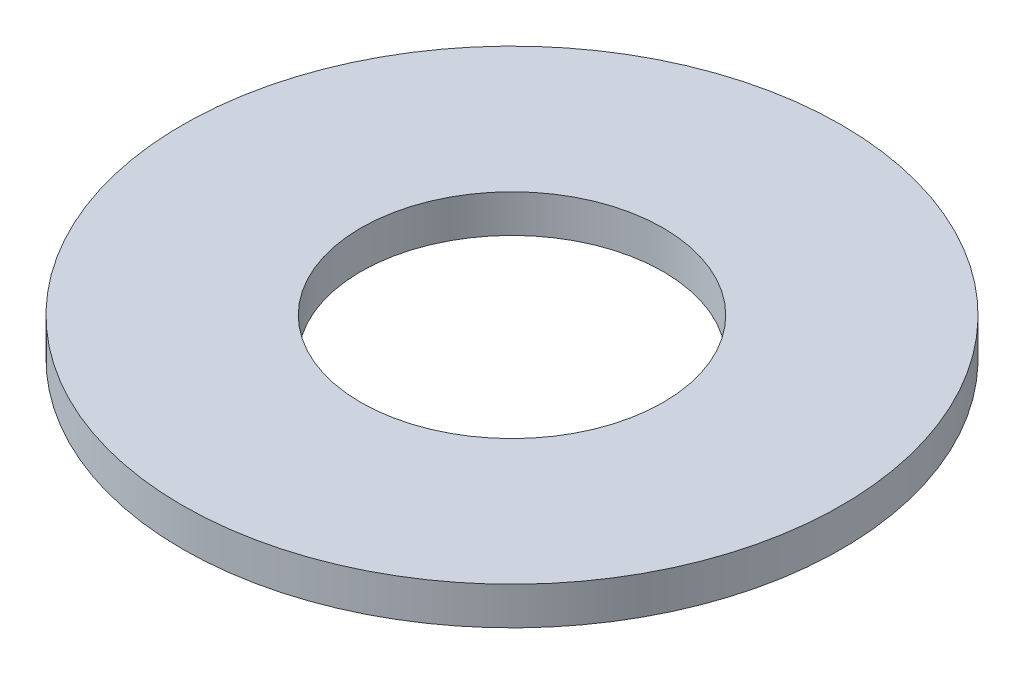
from build123d import *

# Parameters (mm, degrees)
SKETCH1_R           = 9.525
BOSS_EXTRUDE1_DEPTH = 1.0922
SKETCH5_R           = 4.3688
CUT_EXTRUDE1_DEPTH  = 14.514590295


with BuildPart() as part:
    # Sketch1 → Boss-Extrude1 (new body)
    with BuildSketch(Plane(origin=(0, 0, 0), x_dir=(1, 0, 0), z_dir=(0, 1, 0))):
        with Locations(Location((0, 0, 0), (0, 0, 270))):
            Circle(SKETCH1_R)
    extrude(amount=BOSS_EXTRUDE1_DEPTH)

    # Sketch5 → Cut-Extrude1 (cut, through all)
    with BuildSketch(Plane(origin=(0, 1.0922, 0), x_dir=(-1, 0, 0), z_dir=(0, 1, 0))):
        with Locations(Location((0, 0, 0), (0, 0, 90))):
            Circle(SKETCH5_R)
    extrude(amount=-CUT_EXTRUDE1_DEPTH, mode=Mode.SUBTRACT)


solid = part.part
